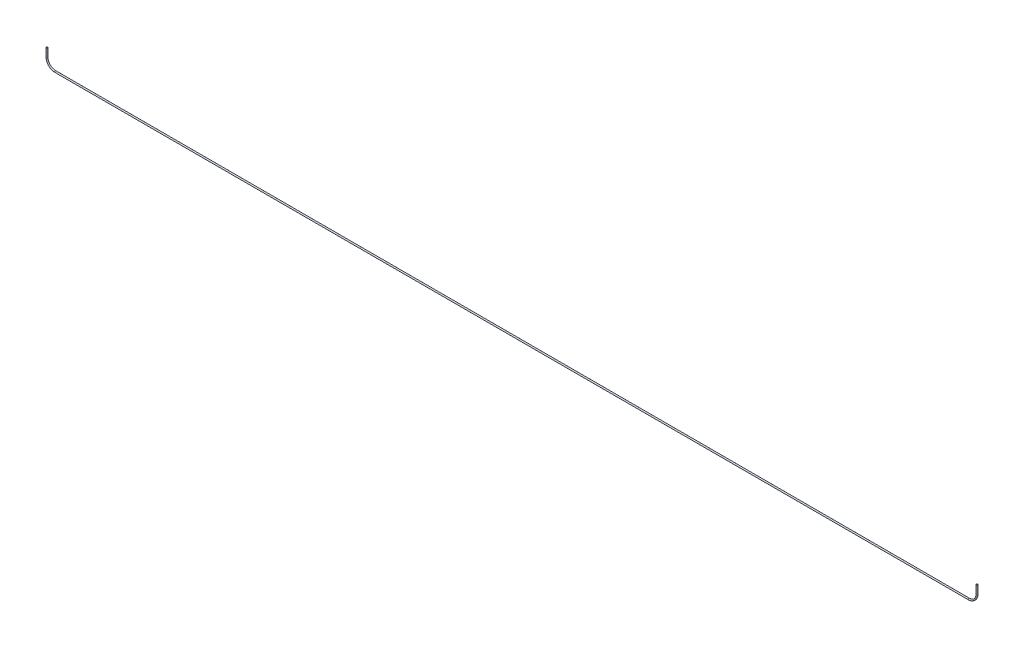
from build123d import *

# Parameters (mm, degrees)
SWEEP1_PROFILE_R = 6.35


with BuildPart() as part:
    # Sweep1: sweep along a path in Sketch1
    with BuildLine(Plane.XY) as sweep1_path:
        Line((-4200, 150), (-4200, 75))
        ThreePointArc((-4200, 75), (-4178.033008589, 21.966991411), (-4125, 0))
        Line((-4125, 0), (4125, 0))
        ThreePointArc((4125, 0), (4178.033008589, 21.966991411), (4200, 75))
        Line((4200, 75), (4200, 150))
    # Sweep1 profile (on start of the path) → Sweep1 (sweep)
    with BuildSketch(Plane(origin=(-4200, 150, 0), x_dir=(0, 0, -1), z_dir=(0, -1, 0))):
        Circle(SWEEP1_PROFILE_R)
    sweep(path=sweep1_path.line)


solid = part.part
